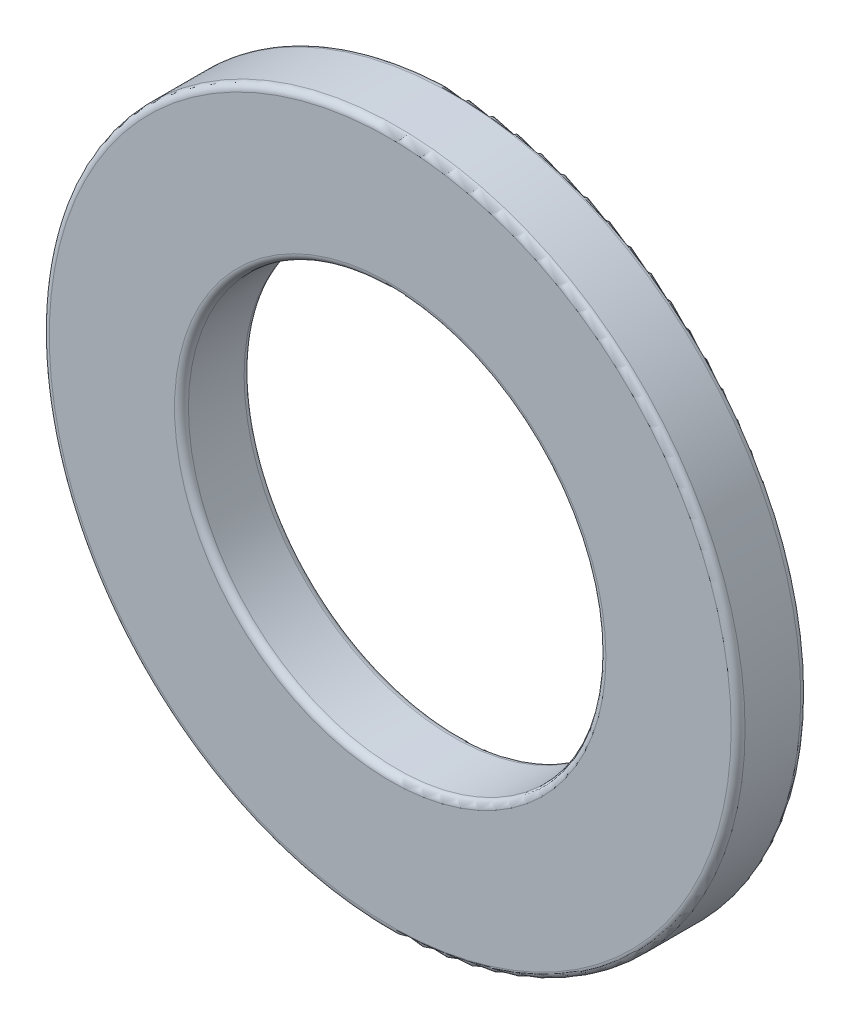
from build123d import *

# Parameters (mm, degrees)
BOSS_EXTRUDE1_DEPTH      = 1.5875
BOSS_EXTRUDE1_DEPTH_BACK = 1.5875
SKETCH3_R                = 15.875
SKETCH3_R_2              = 9.525
FILLET1_R                = 0.3175


with BuildPart() as part:
    # Sketch3 → Boss-Extrude1 (new, two sides: drawn at the far end of the back side and taken through both)
    with BuildSketch(Plane.XY.offset(-BOSS_EXTRUDE1_DEPTH_BACK)):
        Circle(SKETCH3_R)
        Circle(SKETCH3_R_2, mode=Mode.SUBTRACT)
    extrude(amount=BOSS_EXTRUDE1_DEPTH + BOSS_EXTRUDE1_DEPTH_BACK)

    # Fillet1
    fillet1_edges = [part.edges().sort_by_distance(p)[0] for p in [
        (-15.875, 0, 1.5875),
        (-9.525, 0, 1.5875),
        (-15.875, 0, -1.5875),
        (-9.525, 0, -1.5875),
    ]]
    fillet(fillet1_edges, radius=FILLET1_R)


solid = part.part
